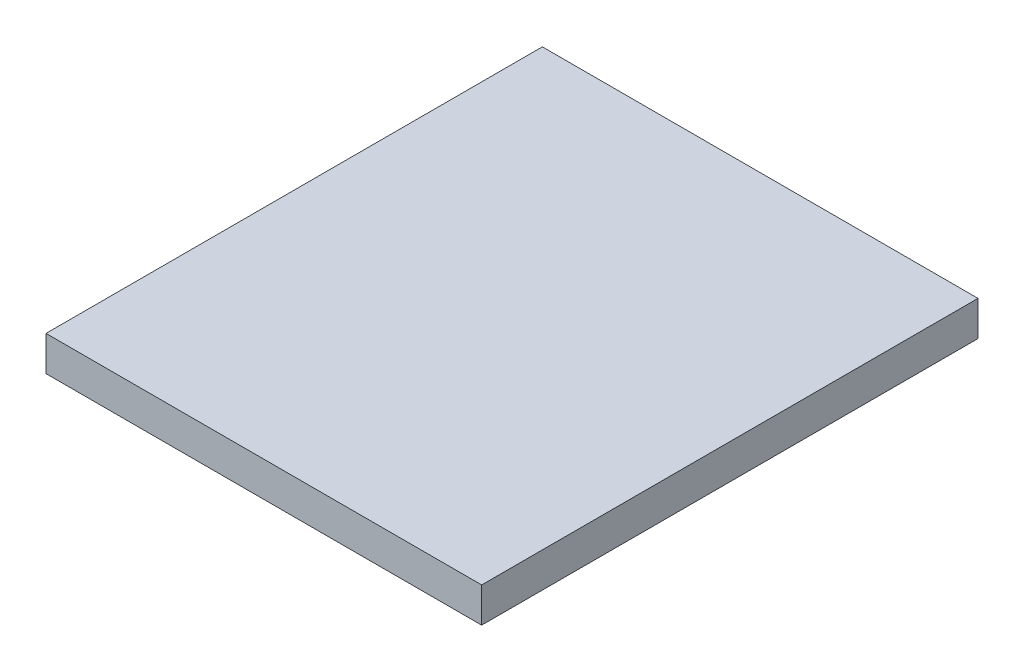
from build123d import *

# Parameters (mm, degrees)
SKETCH1_W           = 100
SKETCH1_H           = 113.93
BOSS_EXTRUDE1_DEPTH = 8


with BuildPart() as part:
    # Sketch1 → Boss-Extrude1 (new body)
    with BuildSketch(Plane(origin=(0, 0, 0), x_dir=(1, 0, 0), z_dir=(0, 1, 0))):
        with Locations((50, 56.965)):
            Rectangle(SKETCH1_W, SKETCH1_H)
    extrude(amount=BOSS_EXTRUDE1_DEPTH)


solid = part.part
